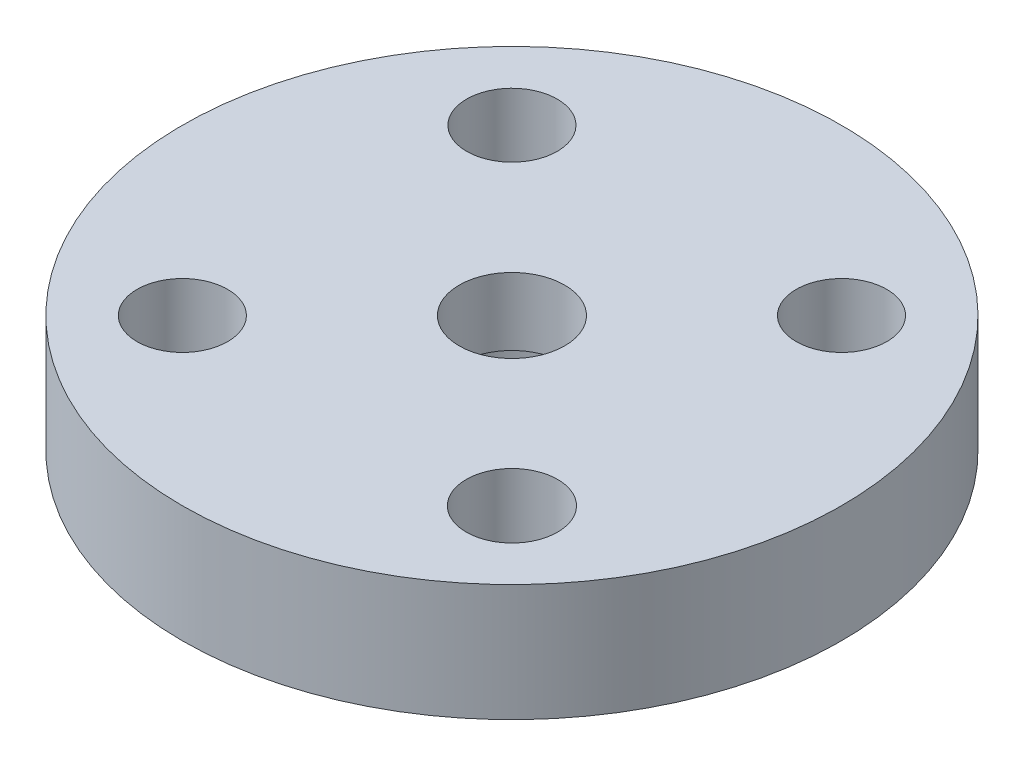
from build123d import *

# Parameters (mm, degrees)
SKETCH1_R           = 10
SKETCH1_R_2         = 1.6
SKETCH1_R_3         = 1.375
SKETCH1_R_4         = 1.386376747
BOSS_EXTRUDE1_DEPTH = 3.55
SKETCH2_W           = 1.7
SKETCH2_H           = 3.5
CUT_EXTRUDE1_START  = -1.5
SKETCH3_R           = 2.8
CUT_EXTRUDE1_DEPTH  = 1.5


with BuildPart() as part:
    # Sketch1 → Boss-Extrude1 (new body)
    with BuildSketch(Plane(origin=(0, 0, 0), x_dir=(1, 0, 0), z_dir=(0, 1, 0))):
        with Locations(Location((0, 0, 0), (0, 0, 270))):
            Circle(SKETCH1_R)
        with Locations(Location((0, 0, 0), (0, 0, 270))):
            Circle(SKETCH1_R_2, mode=Mode.SUBTRACT)
        with Locations(Location((-5, -5, 0), (0, 0, 270))):
            Circle(SKETCH1_R_3, mode=Mode.SUBTRACT)
        with Locations(Location((5, -5, 0), (0, 0, 270))):
            Circle(SKETCH1_R_4, mode=Mode.SUBTRACT)
        with Locations(Location((5, 5, 0), (0, 0, 270))):
            Circle(SKETCH1_R_3, mode=Mode.SUBTRACT)
        with Locations(Location((-5, 5, 0), (0, 0, 270))):
            Circle(SKETCH1_R_3, mode=Mode.SUBTRACT)
    extrude(amount=BOSS_EXTRUDE1_DEPTH)

    # Sketch2 → Revolve1 (revolve)
    with BuildSketch(Plane.XY, mode=Mode.PRIVATE) as revolve1_sk:
        with Locations((-3.65, -0.25)):
            Rectangle(SKETCH2_W, SKETCH2_H)
    revolve(revolve1_sk.sketch.rotate(Axis((0, 0, 0), (0, -1, 0)), 270), axis=Axis((0, 0, 0), (0, -1, 0)))

    # Sketch3 → Cut-Extrude1 (cut)
    with BuildSketch(Plane.XZ.offset(CUT_EXTRUDE1_START)):
        with Locations(Location((0, 0, 0), (0, 0, 90))):
            Circle(SKETCH3_R)
    extrude(amount=CUT_EXTRUDE1_DEPTH, mode=Mode.SUBTRACT)


solid = part.part
